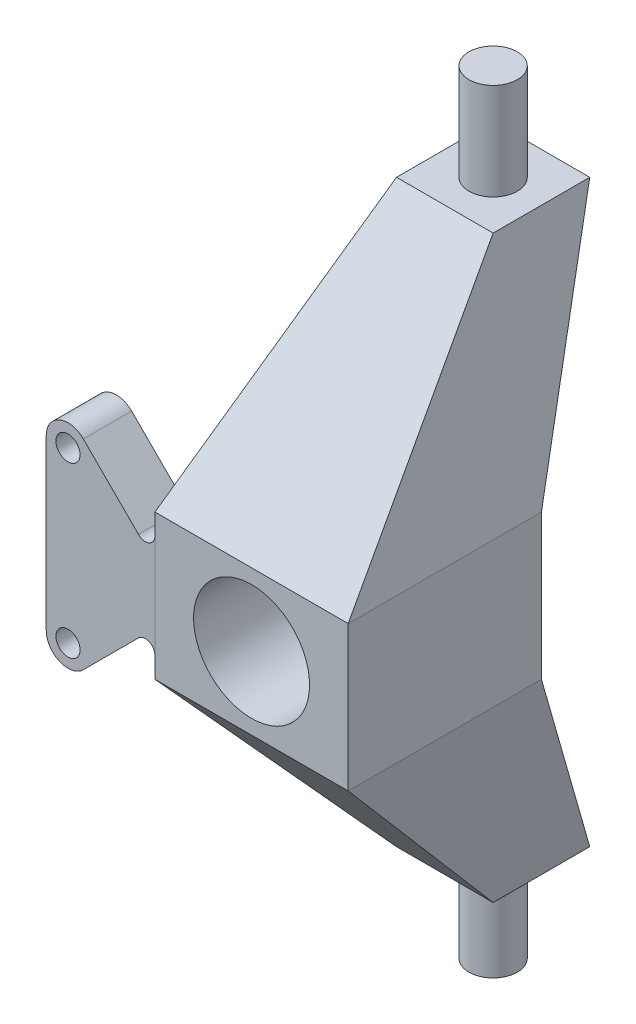
from build123d import *

# Parameters (mm, degrees)
BOSS_EXTRUDE1_DEPTH     = 20
CUT_EXTRUDE1_DEPTH      = 88.177978871
CUT_EXTRUDE1_DEPTH_BACK = 88.177978871
SKETCH2_R               = 12
SKETCH3_R               = 2.5
BOSS_EXTRUDE2_DEPTH     = 10
SKETCH5_R               = 5
BOSS_EXTRUDE3_DEPTH     = 20
CUT_EXTRUDE2_DEPTH      = 109.656569061


with BuildPart() as part:
    # Sketch1 → Boss-Extrude1 (new, symmetric)
    with BuildSketch(Plane(origin=(0, 0, 0), x_dir=(0, 0, -1), z_dir=(1, 0, 0))):
        Polygon((-20, 0), (20, 0), (20, 15), (40, 60), (20, 60), (-20, 15), align=None)
        Polygon((20, -15), (20, 0), (-20, 0), (-20, -15), (20, -60), (40, -60), align=None)
    extrude(amount=BOSS_EXTRUDE1_DEPTH, both=True)

    # Sketch2 → Cut-Extrude1 (cut, two sides: drawn at the far end of the back side and taken through both)
    with BuildSketch(Plane.XY.offset(20).offset(-CUT_EXTRUDE1_DEPTH_BACK)):
        Circle(SKETCH2_R)
    extrude(amount=CUT_EXTRUDE1_DEPTH + CUT_EXTRUDE1_DEPTH_BACK, mode=Mode.SUBTRACT)

    # Sketch5 → Boss-Extrude3 (add)
    with BuildSketch(Plane(origin=(0, 60, 0), x_dir=(1, 0, 0), z_dir=(0, 1, 0))):
        with Locations(Location((0, 30, 0), (0, 0, 270))):
            Circle(SKETCH5_R)
    boss_extrude3 = extrude(amount=BOSS_EXTRUDE3_DEPTH)

    # Mirror1: Boss-Extrude3 across plane
    add(boss_extrude3.mirror(Plane.ZX))

    # Sketch6 → Cut-Extrude2 (cut, symmetric)
    with BuildSketch(Plane.XY.offset(20)):
        Polygon((20, 15), (20, 60), (10, 60), align=None)
        Polygon((-20, 60), (-20, 15), (-10, 60), align=None)
    cut_extrude2 = extrude(amount=CUT_EXTRUDE2_DEPTH, both=True, mode=Mode.SUBTRACT)

    # Mirror2: Cut-Extrude2 across plane
    add(cut_extrude2.mirror(Plane.ZX), mode=Mode.SUBTRACT)


with BuildPart() as body_2:
    # Sketch3 → Boss-Extrude2 (new body)
    with BuildSketch(Plane.XY.offset(20)):
        with BuildLine():
            ThreePointArc((-20, 10.692388155), (-21.234633135, 8.84462909), (-23.414213562, 9.278174593))
            Line((-23.414213562, 9.278174593), (-34.818019485, 20.681980515))
            ThreePointArc((-34.818019485, 20.681980515), (-39.722075446, 21.657457896), (-42.5, 17.5))
            Line((-42.5, 17.5), (-42.5, -17.5))
            ThreePointArc((-42.5, -17.5), (-39.722075446, -21.657457896), (-34.818019485, -20.681980515))
            Line((-34.818019485, -20.681980515), (-23.414213562, -9.278174593))
            ThreePointArc((-23.414213562, -9.278174593), (-21.234633135, -8.84462909), (-20, -10.692388155))
            Line((-20, -10.692388155), (-20, 10.692388155))
        make_face()
        with Locations((-38, -17.5)):
            Circle(SKETCH3_R, mode=Mode.SUBTRACT)
        with Locations((-38, 17.5)):
            Circle(SKETCH3_R, mode=Mode.SUBTRACT)
    extrude(amount=-BOSS_EXTRUDE2_DEPTH)


solid = Compound([part.part, body_2.part])
